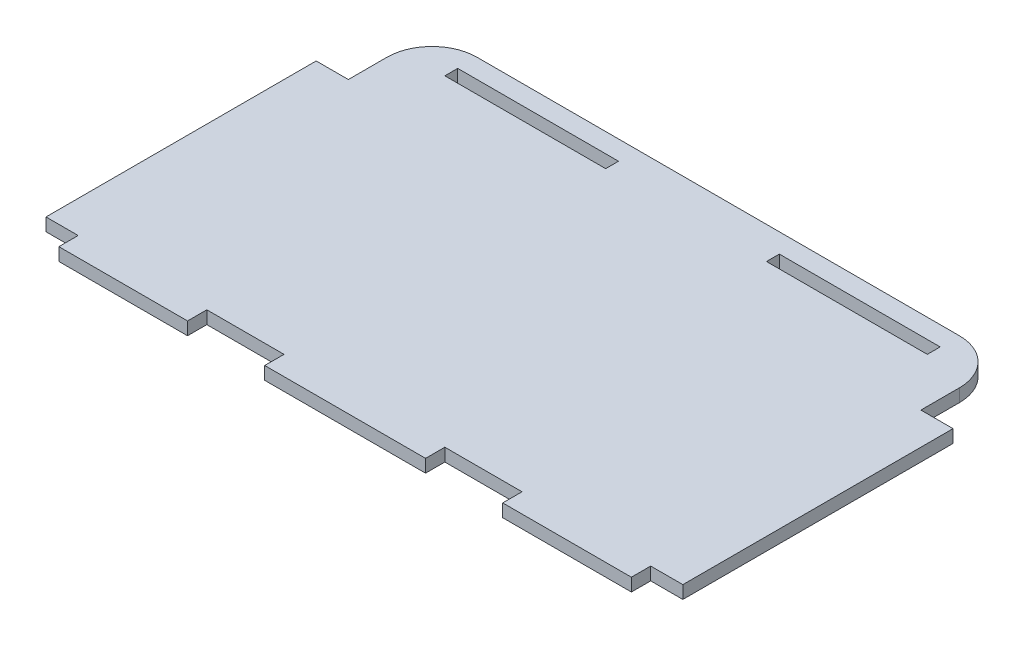
from build123d import *

# Parameters (mm, degrees)
ESTRUSIONE_ESTRUSIONE1_DEPTH      = 45
ESTRUSIONE_ESTRUSIONE1_DEPTH_BACK = 3
SCHIZZO1_W                        = 89
SCHIZZO1_H                        = 2
SCHIZZO2_W                        = 12
SCHIZZO2_H                        = 3
TAGLIO_ESTRUSIONE1_DEPTH          = 10
SCHIZZO3_W                        = 42
SCHIZZO3_H                        = 2
ESTRUSIONE_ESTRUSIONE2_DEPTH      = 5
SCHIZZO4_W                        = 89
SCHIZZO4_H                        = 2
ESTRUSIONE_ESTRUSIONE3_DEPTH      = 10
SCHIZZO5_W                        = 25
SCHIZZO5_H                        = 2
TAGLIO_ESTRUSIONE2_DEPTH          = 8
RACCORDO1_R                       = 7


with BuildPart() as part:
    # Schizzo1 → Estrusione-Estrusione1 (new, two sides: drawn at the far end of the back side and taken through both)
    with BuildSketch(Plane.XY.offset(-ESTRUSIONE_ESTRUSIONE1_DEPTH_BACK)):
        with Locations((0, -22.5)):
            Rectangle(SCHIZZO1_W, SCHIZZO1_H)
    extrude(amount=ESTRUSIONE_ESTRUSIONE1_DEPTH + ESTRUSIONE_ESTRUSIONE1_DEPTH_BACK)

    # Schizzo2 → Taglio-Estrusione1 (cut)
    with BuildSketch(Plane(origin=(0, -21.5, 0), x_dir=(1, 0, 0), z_dir=(0, 1, 0))):
        with Locations((18.5, -43.5)):
            Rectangle(SCHIZZO2_W, SCHIZZO2_H)
        with Locations((-18.5, -43.5)):
            Rectangle(SCHIZZO2_W, SCHIZZO2_H)
    extrude(amount=-TAGLIO_ESTRUSIONE1_DEPTH, mode=Mode.SUBTRACT)

    # Schizzo3 → Estrusione-Estrusione2 (add)
    with BuildSketch(Plane(origin=(44.5, 0, 0), x_dir=(0, 0, -1), z_dir=(1, 0, 0))):
        with Locations((-21, -22.5)):
            Rectangle(SCHIZZO3_W, SCHIZZO3_H)
    estrusione_estrusione2 = extrude(amount=ESTRUSIONE_ESTRUSIONE2_DEPTH)

    # Specchia1: Estrusione-Estrusione2 across plane
    add(estrusione_estrusione2.mirror(Plane(origin=(0, 0, 0), x_dir=(0, 0, 1), z_dir=(1, 0, 0))))

    # Schizzo4 → Estrusione-Estrusione3 (add)
    with BuildSketch(Plane(origin=(0, 0, -3), x_dir=(-1, 0, 0), z_dir=(0, 0, -1))):
        with Locations((0, -22.5)):
            Rectangle(SCHIZZO4_W, SCHIZZO4_H)
    extrude(amount=ESTRUSIONE_ESTRUSIONE3_DEPTH)

    # Schizzo5 → Taglio-Estrusione2 (cut)
    with BuildSketch(Plane(origin=(0, -21.5, 0), x_dir=(1, 0, 0), z_dir=(0, 1, 0))):
        with Locations((-25, 9)):
            Rectangle(SCHIZZO5_W, SCHIZZO5_H)
        with Locations((25, 9)):
            Rectangle(SCHIZZO5_W, SCHIZZO5_H)
    extrude(amount=-TAGLIO_ESTRUSIONE2_DEPTH, mode=Mode.SUBTRACT)

    # Raccordo1
    raccordo1_edges = [part.edges().sort_by_distance(p)[0] for p in [
        (-44.5, -22.5, -13),
        (44.5, -22.5, -13),
    ]]
    fillet(raccordo1_edges, radius=RACCORDO1_R)


solid = part.part
